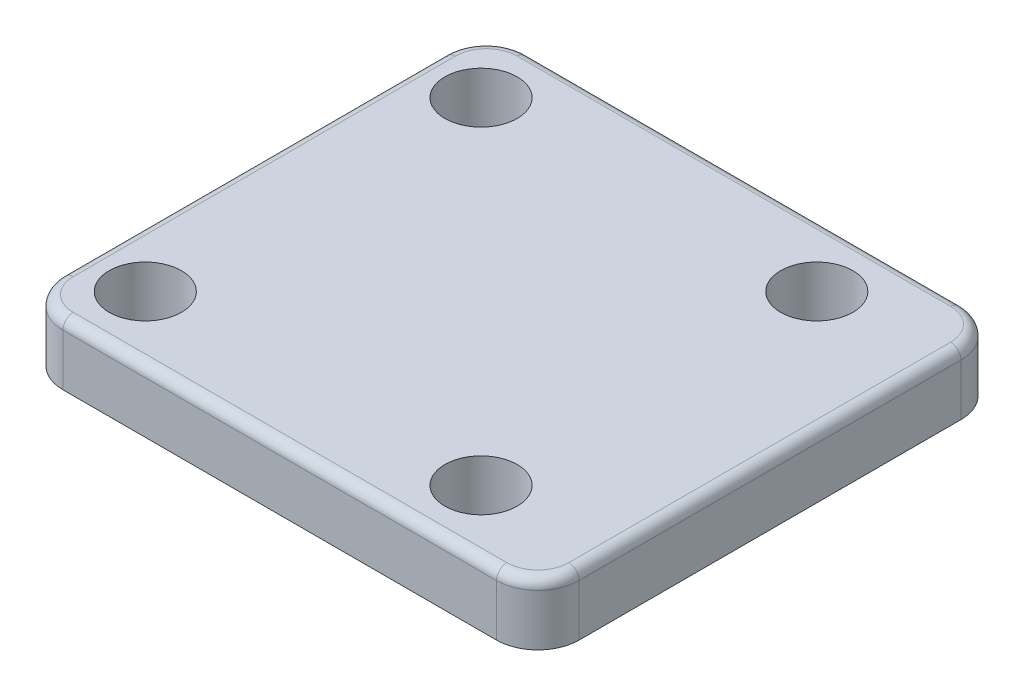
from build123d import *

# Parameters (mm, degrees)
BOSS_EXTRUDE1_DEPTH = 6
SKETCH3_R           = 16
BOSS_EXTRUDE2_DEPTH = 2
CHAMFER1_SIZE       = 1
SKETCH4_R           = 3.5
CUT_EXTRUDE1_DEPTH  = 37.800135869
FILLET1_R           = 1


with BuildPart() as part:
    # Sketch2 → Boss-Extrude1 (new body)
    with BuildSketch(Plane(origin=(0, 0, 0), x_dir=(1, 0, 0), z_dir=(0, 1, 0))):
        with BuildLine():
            Line((-18, 22.5), (24, 22.5))
            ThreePointArc((24, 22.5), (26.828427125, 21.328427125), (28, 18.5))
            Line((28, 18.5), (28, -18.5))
            ThreePointArc((28, -18.5), (26.828427125, -21.328427125), (24, -22.5))
            Line((24, -22.5), (-18, -22.5))
            ThreePointArc((-18, -22.5), (-20.828427125, -21.328427125), (-22, -18.5))
            Line((-22, -18.5), (-22, 18.5))
            ThreePointArc((-22, 18.5), (-20.828427125, 21.328427125), (-18, 22.5))
        make_face()
    extrude(amount=BOSS_EXTRUDE1_DEPTH)

    # Sketch3 → Boss-Extrude2 (add)
    with BuildSketch(Plane.XZ):
        with Locations(Location((0, 0, 0), (0, 0, 270))):
            Circle(SKETCH3_R)
    extrude(amount=BOSS_EXTRUDE2_DEPTH)

    # Chamfer1
    chamfer1_edges = [part.edges().sort_by_distance(p)[0] for p in [
        (0, -2, 16),
    ]]
    chamfer(chamfer1_edges, length=CHAMFER1_SIZE)

    # Sketch4 → Cut-Extrude1 (cut, through all)
    with BuildSketch(Plane(origin=(0, 6, 0), x_dir=(1, 0, 0), z_dir=(0, 1, 0))):
        with Locations(Location((16.263455967, 16.263455967, 0), (0, 0, 270))):
            Circle(SKETCH4_R)
        with Locations(Location((16.263455967, -16.263455967, 0), (0, 0, 270))):
            Circle(SKETCH4_R)
        with Locations(Location((-16.263455967, -16.263455967, 0), (0, 0, 270))):
            Circle(SKETCH4_R)
        with Locations(Location((-16.263455967, 16.263455967, 0), (0, 0, 270))):
            Circle(SKETCH4_R)
    extrude(amount=-CUT_EXTRUDE1_DEPTH, mode=Mode.SUBTRACT)

    # Fillet1
    fillet1_edges = [part.edges().sort_by_distance(p)[0] for p in [
        (-20.828427125, 6, -21.328427125),
        (-22, 6, 0),
        (-20.828427125, 6, 21.328427125),
        (3, 6, 22.5),
        (26.828427125, 6, 21.328427125),
        (28, 6, 0),
        (26.828427125, 6, -21.328427125),
        (3, 6, -22.5),
    ]]
    fillet(fillet1_edges, radius=FILLET1_R)


solid = part.part
